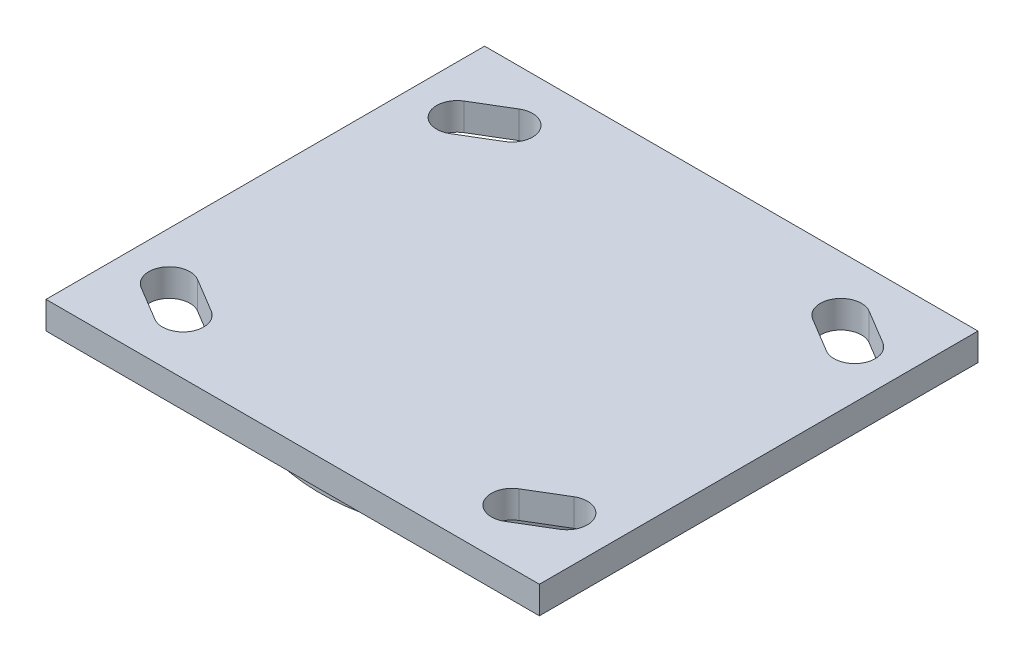
from build123d import *

# Parameters (mm, degrees)
SKETCH1_W               = 114.3
SKETCH1_H               = 6.35
BOSS_EXTRUDE1_DEPTH     = 50.8
F_1_2_HOLES_DEPTH       = 77.727342
BOSS_EXTRUDE5_DEPTH     = 6.35
BOSS_EXTRUDE6_DEPTH     = 4.7625
SKETCH15_R              = 3.96875
BOSS_EXTRUDE7_DEPTH     = 2.54
SKETCH16_R              = 6.35
BOSS_EXTRUDE8_DEPTH     = 4.7625
SKETCH7_W               = 200.622007
SKETCH7_H               = 97.79
BOSS_EXTRUDE2_DEPTH     = 225.2599
CUT_EXTRUDE1_DEPTH      = 322.008202
CUT_EXTRUDE1_DEPTH_BACK = 322.008202
CUT_EXTRUDE3_DEPTH      = 230.782863
CUT_EXTRUDE3_DEPTH_BACK = 230.782863
SKETCH9_OUTSIDE_W       = 174.676
SKETCH9_OUTSIDE_H       = 325.489
BOSS_EXTRUDE3_DEPTH     = 7.9375
SKETCH11_OUTSIDE_W      = 1426.344
SKETCH11_OUTSIDE_H      = 1450.156
SKETCH11_OUTSIDE_R      = 11.1125
CUT_EXTRUDE4_DEPTH      = 324.56132
CUT_EXTRUDE4_DRAFT      = -60
SKETCH12_R              = 10.795
BOSS_EXTRUDE4_DEPTH     = 85.09
SKETCH17_R              = 1440.18
CUT_EXTRUDE5_DEPTH      = 1397


with BuildPart() as part:
    # Sketch1 → Boss-Extrude1 (new, symmetric)
    with BuildSketch(Plane.XY):
        with Locations((0, -3.175)):
            Rectangle(SKETCH1_W, SKETCH1_H)
    extrude(amount=BOSS_EXTRUDE1_DEPTH, both=True)

    # Sketch2 → 1-2 holes (cut, through all)
    with BuildSketch(Plane(origin=(0, 0, 0), x_dir=(1, 0, 0), z_dir=(0, 1, 0))):
        with BuildLine():
            Line((-35.649714, 34.01619), (-43.587214, 29.25369))
            ThreePointArc((-43.587214, 29.25369), (-50.12131, 30.887214), (-48.487786, 37.42131))
            Line((-48.487786, 37.42131), (-40.550286, 42.18381))
            ThreePointArc((-40.550286, 42.18381), (-34.01619, 40.550286), (-35.649714, 34.01619))
        make_face()
        with BuildLine():
            Line((-35.649714, -34.01619), (-43.587214, -29.25369))
            ThreePointArc((-43.587214, -29.25369), (-50.12131, -30.887214), (-48.487786, -37.42131))
            Line((-48.487786, -37.42131), (-40.550286, -42.18381))
            ThreePointArc((-40.550286, -42.18381), (-34.01619, -40.550286), (-35.649714, -34.01619))
        make_face()
        with BuildLine():
            Line((35.649714, 34.01619), (43.587214, 29.25369))
            ThreePointArc((43.587214, 29.25369), (50.12131, 30.887214), (48.487786, 37.42131))
            Line((48.487786, 37.42131), (40.550286, 42.18381))
            ThreePointArc((40.550286, 42.18381), (34.01619, 40.550286), (35.649714, 34.01619))
        make_face()
        with BuildLine():
            Line((35.649714, -34.01619), (43.587214, -29.25369))
            ThreePointArc((43.587214, -29.25369), (50.12131, -30.887214), (48.487786, -37.42131))
            Line((48.487786, -37.42131), (40.550286, -42.18381))
            ThreePointArc((40.550286, -42.18381), (34.01619, -40.550286), (35.649714, -34.01619))
        make_face()
    extrude(amount=-F_1_2_HOLES_DEPTH, mode=Mode.SUBTRACT)


with BuildPart() as body_2:
    # Sketch4 → Revolve1 (revolve)
    with BuildSketch(Plane.XY, mode=Mode.PRIVATE) as revolve1_sk:
        Polygon((0, -27.1526), (43.18, -27.1526), (43.18, -16.0401), (40.64, -16.0401), (40.64, -13.5001), (44.45, -13.5001), (44.45, -6.35), (0, -6.35), align=None)
    revolve(revolve1_sk.sketch.rotate(Axis((0, -6.35, 0), (0, -1, 0)), 180), axis=Axis((0, -6.35, 0), (0, -1, 0)))


with BuildPart() as body_3:
    # Sketch6 → Revolve2 (revolve)
    with BuildSketch(Plane(origin=(-69.85, 0, 0), x_dir=(0, 0, -1), z_dir=(1, 0, 0)), mode=Mode.PRIVATE) as revolve2_sk:
        with BuildLine():
            Line((-35.56, -89.8525), (-35.56, -62.143409))
            ThreePointArc((-35.56, -62.143409), (-31.772624, -52.999876), (-22.629091, -49.2125))
            Line((-22.629091, -49.2125), (-19.800455, -49.2125))
            Line((-19.800455, -49.2125), (-19.800455, -51.59375))
            Line((-19.800455, -51.59375), (-14.143182, -51.59375))
            Line((-14.143182, -51.59375), (-14.143182, -49.2125))
            Line((-14.143182, -49.2125), (-8.485909, -49.2125))
            Line((-8.485909, -49.2125), (-8.485909, -51.59375))
            Line((-8.485909, -51.59375), (-2.828636, -51.59375))
            Line((-2.828636, -51.59375), (-2.828636, -49.2125))
            Line((-2.828636, -49.2125), (2.828636, -49.2125))
            Line((2.828636, -49.2125), (2.828636, -51.59375))
            Line((2.828636, -51.59375), (8.485909, -51.59375))
            Line((8.485909, -51.59375), (8.485909, -49.2125))
            Line((8.485909, -49.2125), (14.143182, -49.2125))
            Line((14.143182, -49.2125), (14.143182, -51.59375))
            Line((14.143182, -51.59375), (19.800455, -51.59375))
            Line((19.800455, -51.59375), (19.800455, -49.2125))
            Line((19.800455, -49.2125), (22.629091, -49.2125))
            ThreePointArc((22.629091, -49.2125), (31.772624, -52.999876), (35.56, -62.143409))
            Line((35.56, -62.143409), (35.56, -89.8525))
            Line((35.56, -89.8525), (36.83, -89.8525))
            Line((36.83, -89.8525), (36.83, -92.3925))
            Line((36.83, -92.3925), (33.655, -92.3925))
            ThreePointArc((33.655, -92.3925), (29.164872, -94.252372), (27.305, -98.7425))
            ThreePointArc((27.305, -98.7425), (25.636711, -103.032498), (21.508439, -105.068336))
            Line((21.508439, -105.068336), (5.438281, -106.474293))
            ThreePointArc((5.438281, -106.474293), (3.374144, -107.492212), (2.54, -109.637211))
            Line((2.54, -109.637211), (2.54, -130.175))
            Line((2.54, -130.175), (36.83, -130.175))
            Line((36.83, -130.175), (40.005, -130.175))
            Line((40.005, -130.175), (40.005, -150.8125))
            Line((40.005, -150.8125), (-40.005, -150.8125))
            Line((-40.005, -150.8125), (-40.005, -130.175))
            Line((-40.005, -130.175), (-36.83, -130.175))
            Line((-36.83, -130.175), (-2.54, -130.175))
            Line((-2.54, -130.175), (-2.54, -109.637211))
            ThreePointArc((-2.54, -109.637211), (-3.374144, -107.492212), (-5.438281, -106.474293))
            Line((-5.438281, -106.474293), (-21.508439, -105.068336))
            ThreePointArc((-21.508439, -105.068336), (-25.636711, -103.032498), (-27.305, -98.7425))
            ThreePointArc((-27.305, -98.7425), (-29.164872, -94.252372), (-33.655, -92.3925))
            Line((-33.655, -92.3925), (-36.83, -92.3925))
            Line((-36.83, -92.3925), (-36.83, -89.8525))
            Line((-36.83, -89.8525), (-35.56, -89.8525))
        make_face()
    revolve(revolve2_sk.sketch.rotate(Axis((-69.85, -150.8125, 111.145304), (0, 0, -1)), 90), axis=Axis((-69.85, -150.8125, 111.145304), (0, 0, -1)))

    # Sketch13 → Boss-Extrude5 (add)
    with BuildSketch(Plane.XY.offset(2.54)):
        with BuildLine():
            ThreePointArc((-101.041813, -136.474589), (-98.965326, -121.697174), (-84.187911, -119.620687))
            ThreePointArc((-84.187911, -119.620687), (-69.85, -123.32907), (-55.512089, -119.620687))
            ThreePointArc((-55.512089, -119.620687), (-40.734674, -121.697174), (-38.658187, -136.474589))
            ThreePointArc((-38.658187, -136.474589), (-42.36657, -150.8125), (-38.658187, -165.150411))
            ThreePointArc((-38.658187, -165.150411), (-40.734674, -179.927826), (-55.512089, -182.004313))
            ThreePointArc((-55.512089, -182.004313), (-69.85, -178.29593), (-84.187911, -182.004313))
            ThreePointArc((-84.187911, -182.004313), (-98.965326, -179.927826), (-101.041813, -165.150411))
            ThreePointArc((-101.041813, -165.150411), (-97.33343, -150.8125), (-101.041813, -136.474589))
        make_face()
    extrude(amount=BOSS_EXTRUDE5_DEPTH)

    # Sketch14 → Boss-Extrude6 (add)
    with BuildSketch(Plane.XY.offset(8.89)):
        Polygon((-94.124523, -132.037239), (-89.362023, -129.287608), (-89.362023, -123.788347), (-94.124523, -121.038716), (-98.887023, -123.788347), (-98.887023, -129.287608), align=None)
        Polygon((-40.812977, -129.287608), (-45.575477, -132.037239), (-50.337977, -129.287608), (-50.337977, -123.788347), (-45.575477, -121.038716), (-40.812977, -123.788347), align=None)
        Polygon((-45.575477, -169.587761), (-50.337977, -172.337392), (-50.337977, -177.836653), (-45.575477, -180.586284), (-40.812977, -177.836653), (-40.812977, -172.337392), align=None)
        Polygon((-98.887023, -172.337392), (-94.124523, -169.587761), (-89.362023, -172.337392), (-89.362023, -177.836653), (-94.124523, -180.586284), (-98.887023, -177.836653), align=None)
    extrude(amount=BOSS_EXTRUDE6_DEPTH)

    # Sketch15 → Boss-Extrude7 (add)
    with BuildSketch(Plane.XY.offset(13.6525)):
        with Locations((-94.124523, -126.537977)):
            Circle(SKETCH15_R)
        with Locations(Location((-45.575477, -126.537977, 0), (0, 0, 180))):
            Circle(SKETCH15_R)
        with Locations(Location((-94.124523, -175.087023, 0), (0, 0, 180))):
            Circle(SKETCH15_R)
        with Locations((-45.575477, -175.087023)):
            Circle(SKETCH15_R)
    extrude(amount=BOSS_EXTRUDE7_DEPTH)

    # Sketch16 → Boss-Extrude8 (add)
    with BuildSketch(Plane(origin=(0, 0, -2.54), x_dir=(-1, 0, 0), z_dir=(0, 0, -1))):
        with Locations(Location((45.575477, -126.537977, 0), (0, 0, 180))):
            Circle(SKETCH16_R)
        with Locations(Location((94.124523, -126.537977, 0), (0, 0, 180))):
            Circle(SKETCH16_R)
        with Locations(Location((94.124523, -175.087023, 0), (0, 0, 180))):
            Circle(SKETCH16_R)
        with Locations(Location((45.575477, -175.087023, 0), (0, 0, 180))):
            Circle(SKETCH16_R)
    extrude(amount=BOSS_EXTRUDE8_DEPTH)



with BuildPart() as body_4:
    # Sketch7 → Boss-Extrude2 (new body)
    with BuildSketch(Plane.XZ.offset(27.1526)):
        with Locations((-71.138996, 0)):
            Rectangle(SKETCH7_W, SKETCH7_H)
    extrude(amount=BOSS_EXTRUDE2_DEPTH)

    # Sketch8 → Cut-Extrude1 (cut, two sides: drawn at the far end of the back side and taken through both)
    with BuildSketch(Plane.XY.offset(48.895).offset(-CUT_EXTRUDE1_DEPTH_BACK)):
        with BuildLine():
            Line((330.801873, 506.841945), (29.172007, -27.1526))
            Line((29.172007, -27.1526), (-47.734278, -163.304692))
            ThreePointArc((-47.734278, -163.304692), (-82.342192, -172.928222), (-91.965722, -138.320308))
            Line((-91.965722, -138.320308), (-29.172007, -27.1526))
            Line((-29.172007, -27.1526), (272.457858, 506.841945))
            Line((272.457858, 506.841945), (272.457858, -719.748043))
            Line((272.457858, -719.748043), (330.801873, -719.748043))
            Line((330.801873, -719.748043), (330.801873, 506.841945))
        make_face()
    extrude(amount=CUT_EXTRUDE1_DEPTH + CUT_EXTRUDE1_DEPTH_BACK, mode=Mode.SUBTRACT)

    # Sketch9 outside → Cut-Extrude3 (cut, two sides: drawn at the far end of the back side and taken through both)
    with BuildSketch(Plane(origin=(0, -144.306694, 0), x_dir=(0, 0, -1), z_dir=(-1, 0, 0)).offset(-CUT_EXTRUDE3_DEPTH_BACK)):
        with Locations((0, -18.1005)):
            Rectangle(SKETCH9_OUTSIDE_W, SKETCH9_OUTSIDE_H)
        Polygon((48.895, 108.105806), (48.895, -95.094194), (31.835615, -117.154094), (25.485615, -117.154094), (42.545, -95.094194), (42.545, 108.105806), align=None, mode=Mode.SUBTRACT)
        Polygon((-25.485615, -117.154094), (-31.835615, -117.154094), (-48.895, -95.094194), (-48.895, 108.105806), (-42.545, 108.105806), (-42.545, -95.094194), align=None, mode=Mode.SUBTRACT)
    extrude(amount=CUT_EXTRUDE3_DEPTH + CUT_EXTRUDE3_DEPTH_BACK, mode=Mode.SUBTRACT)


with BuildPart() as cut_extrude3_piece_1:
    # of the separate pieces the step leaves, piece 1, a body of its own (cut_extrude3_pieces)
    add(body_4.part.solids().sort_by_distance((16.711347, -49.2125, 48.895))[0])


with BuildPart() as cut_extrude3_piece_2:
    # of the separate pieces the step leaves, piece 2, a body of its own (cut_extrude3_pieces)
    add(body_4.part.solids().sort_by_distance((29.172007, -27.1526, -31.835615))[0])


with BuildPart() as body_6:
    # Sketch10 → Boss-Extrude3 (new body)
    with BuildSketch(Plane.XY.offset(48.895)):
        Polygon((-69.85, -137.98089), (-80.9625, -144.396695), (-80.9625, -157.228305), (-69.85, -163.64411), (-58.7375, -157.228305), (-58.7375, -144.396695), align=None)
    extrude(amount=BOSS_EXTRUDE3_DEPTH)


with BuildPart() as cut_extrude4_tool:
    # Sketch11 outside → Cut-Extrude4 (with draft: the straight prism first)
    with BuildSketch(Plane.XY.offset(56.8325)):
        with Locations((-57.15, -126.206)):
            Rectangle(SKETCH11_OUTSIDE_W, SKETCH11_OUTSIDE_H)
        with Locations((-69.85, -150.8125)):
            Circle(SKETCH11_OUTSIDE_R, mode=Mode.SUBTRACT)
    extrude(amount=-CUT_EXTRUDE4_DEPTH)
    # Cut-Extrude4: the draft: its side faces are tilted about the plane it starts from
    cut_extrude4_sides = [cut_extrude4_tool.faces().sort_by_distance(p)[0] for p in [
        (-57.15, -851.284, -105.44816),
        (656.022, -126.206, -105.44816),
        (-57.15, 598.872, -105.44816),
        (-770.322, -126.206, -105.44816),
        (-80.9625, -150.8125, -105.44816),
    ]]
    draft(cut_extrude4_sides, Plane.XY.offset(56.8325), CUT_EXTRUDE4_DRAFT)


with BuildPart() as body_6_1:
    add(body_6.part)

    # Cut-Extrude4: cut by cut_extrude4_tool
    add(cut_extrude4_tool.part, mode=Mode.SUBTRACT)


with BuildPart() as body_7:
    # Mirror1: mirrored copy
    add(body_6_1.part.mirror(Plane.XY))


with BuildPart() as body_3_1:
    add(body_3.part)

    add(cut_extrude3_piece_1.part)  # Boss-Extrude4 merges Cut-Extrude3 piece 1

    add(cut_extrude3_piece_2.part)  # Boss-Extrude4 merges Cut-Extrude3 piece 2
    # Sketch12 → Boss-Extrude4 (add)
    with BuildSketch(Plane.XY.offset(-42.545)):
        with Locations((-69.85, -150.8125)):
            Circle(SKETCH12_R)
    extrude(amount=BOSS_EXTRUDE4_DEPTH)

    # Combine1: union body 7, body 6, body 2, part
    add(body_7.part)
    add(body_6_1.part)
    add(body_2.part)
    add(part.part)

    # Sketch17 → Cut-Extrude5 (cut)
    with BuildSketch(Plane.XZ.offset(13.5001)):
        Circle(SKETCH17_R)
    extrude(amount=CUT_EXTRUDE5_DEPTH, mode=Mode.SUBTRACT)


solid = body_3_1.part
